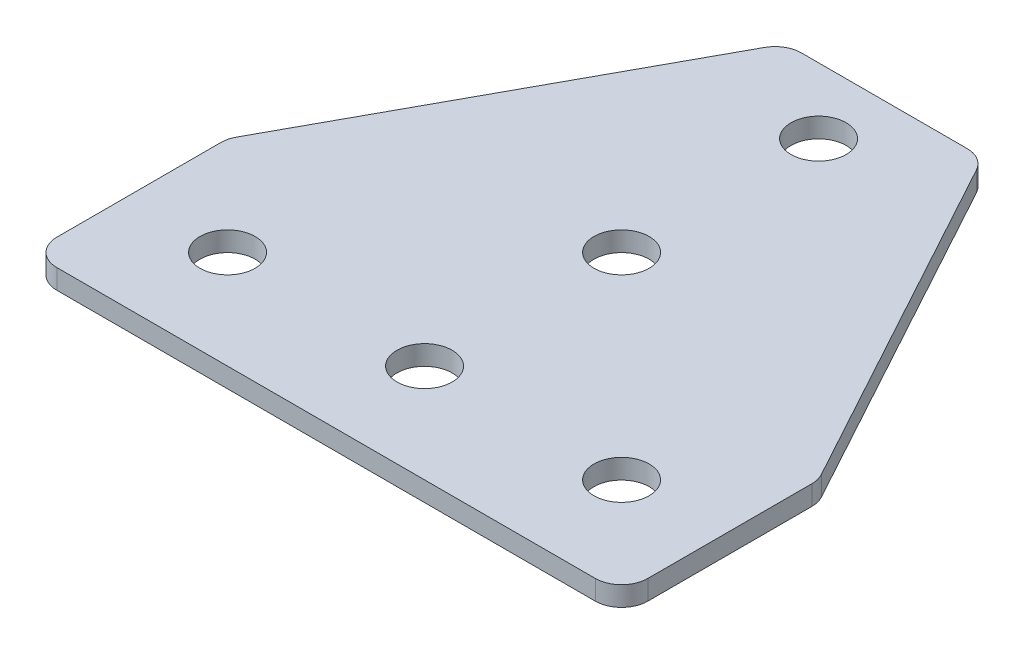
from build123d import *

# Parameters (mm, degrees)
SKETCH_1_R      = 2.1
EXTRUDE_1_DEPTH = 1.5
FILLET_1_R      = 2


with BuildPart() as part:
    # ｽｹｯﾁ1 → ﾎﾞｽ - 押し出し1 (new body)
    with BuildSketch(Plane(origin=(0, 0, 0), x_dir=(1, 0, 0), z_dir=(0, 1, 0))):
        Polygon((0, 0), (45, 0), (45, 15), (30, 42.5), (15, 42.5), (0, 15), align=None)
        with Locations(Location((7.5, 7.5, 0), (0, 0, 270))):
            Circle(SKETCH_1_R, mode=Mode.SUBTRACT)
        with Locations(Location((37.5, 7.5, 0), (0, 0, 90))):
            Circle(SKETCH_1_R, mode=Mode.SUBTRACT)
        with Locations(Location((22.5, 7.5, 0), (0, 0, 270))):
            Circle(SKETCH_1_R, mode=Mode.SUBTRACT)
        with Locations(Location((22.5, 37.5, 0), (0, 0, 270))):
            Circle(SKETCH_1_R, mode=Mode.SUBTRACT)
        with Locations(Location((22.5, 22.5, 0), (0, 0, 270))):
            Circle(SKETCH_1_R, mode=Mode.SUBTRACT)
    extrude(amount=EXTRUDE_1_DEPTH)

    # ﾌｨﾚｯﾄ1
    fillet_1_edges = [part.edges().sort_by_distance(p)[0] for p in [
        (0, 0.75, -15),
        (15, 0.75, -42.5),
        (30, 0.75, -42.5),
        (45, 0.75, -15),
        (45, 0.75, 0),
        (0, 0.75, 0),
    ]]
    fillet(fillet_1_edges, radius=FILLET_1_R)


solid = part.part
